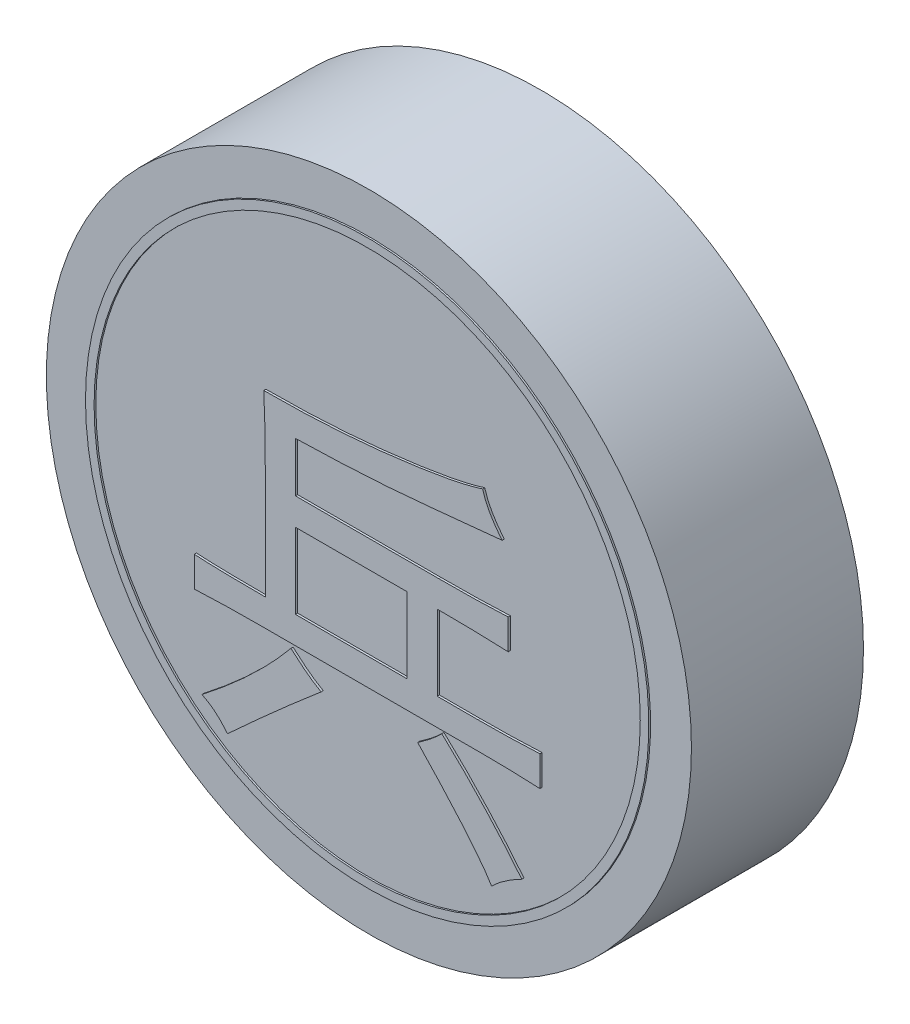
from build123d import *

# Parameters (mm, degrees)
SKETCH_1_R               = 15
DIAMETER30_HEIGHT8_DEPTH = 8
SKETCH_2_W               = 5.192982456
SKETCH_2_H               = 3.508771929
CHARACTER_DEPTH          = 0.1
SKETCH_3_R               = 13.1
SKETCH_3_R_2             = 12.7
INK_RING_DEPTH           = 0.08


with BuildPart() as part:
    # 草图1 → Diameter30_Height8 (new body)
    with BuildSketch(Plane.XY):
        Circle(SKETCH_1_R)
    extrude(amount=-DIAMETER30_HEIGHT8_DEPTH)

    # 草图2 → Character_兵 (add)
    # profile 1 of 3: a face of its own
    with BuildSketch(Plane.XY):
        with BuildLine():
            add(Edge.make_bspline(
                [(5.385964912, 5.675438596), (5.427646333, 5.544154901), (5.514415642, 5.270858182), (5.718534697, 4.870645294), (5.979105034, 4.460896452), (6.189038604, 4.198106369), (6.298245614, 4.061403509)],
                knots=[0, 0, 0, 0, 0.883893952, 1.840025262, 2.876385589, 4, 4, 4, 4], degree=3))
            add(Edge.make_bspline(
                [(6.298245614, 4.061403509), (5.963833471, 4.026716097), (5.279490907, 3.955731615), (4.231500891, 3.847667949), (3.138573287, 3.746554234), (2.199926718, 3.654410468), (1.420771678, 3.589929187), (0.809223667, 3.542341458), (0.175852477, 3.501012073), (-0.480095669, 3.465441213), (-1.157529916, 3.430930645), (-1.857588828, 3.402476855), (-2.579333786, 3.379715375), (-3.06800455, 3.366400533), (-3.315789474, 3.359649123)],
                knots=[0, 0, 0, 0, 1.255148332, 2.568541377, 3.933119286, 5.35274168, 6.089508688, 6.851809632, 7.642688325, 8.45900384, 9.304218247, 10.174988169, 11.074611272, 12, 12, 12, 12], degree=3))
            Line((-3.315789474, 3.359649123), (-3.315789474, 1.043859649))
            Line((-3.315789474, 1.043859649), (3.350877193, 1.043859649))
            add(Edge.make_bspline(
                [(3.350877193, 1.043859649), (3.511157354, 1.043351179), (3.823930109, 1.042358944), (4.282215924, 1.049417071), (4.718886002, 1.053533845), (5.133897674, 1.061104446), (5.526304771, 1.072707016), (5.896383806, 1.080969698), (6.244544047, 1.09823882), (6.469784841, 1.108878558), (6.578947368, 1.114035088)],
                knots=[0, 0, 0, 0, 1.191206585, 2.324535747, 3.406356757, 4.43677056, 5.409393768, 6.324087995, 7.187772401, 8, 8, 8, 8], degree=3))
            Line((6.578947368, 1.114035088), (6.578947368, -0.289473684))
            add(Edge.make_bspline(
                [(6.578947368, -0.289473684), (6.325999471, -0.278216628), (5.805513386, -0.255053199), (5.003105502, -0.23621154), (4.156642469, -0.222539126), (3.577870773, -0.220397737), (3.280701754, -0.219298246)],
                knots=[0, 0, 0, 0, 0.920900528, 1.894919528, 2.91915119, 4, 4, 4, 4], degree=3))
            Line((3.280701754, -0.219298246), (3.280701754, -3.728070175))
            Line((3.280701754, -3.728070175), (5.175438596, -3.728070175))
            add(Edge.make_bspline(
                [(5.175438596, -3.728070175), (5.437087744, -3.726975877), (5.945690026, -3.724848744), (6.687326433, -3.711192023), (7.384937776, -3.692513148), (7.835209995, -3.669167553), (8.052631579, -3.657894737)],
                knots=[0, 0, 0, 0, 1.090812078, 2.120356657, 3.092382303, 4, 4, 4, 4], degree=3))
            Line((8.052631579, -3.657894737), (8.052631579, -5.061403509))
            add(Edge.make_bspline(
                [(8.052631579, -5.061403509), (7.837808318, -5.050169454), (7.399653446, -5.027256405), (6.728050321, -5.008178757), (6.030595105, -4.994576557), (5.556645778, -4.992356355), (5.315789474, -4.99122807)],
                knots=[0, 0, 0, 0, 0.942753637, 1.922846234, 2.944411245, 4, 4, 4, 4], degree=3))
            Line((5.315789474, -4.99122807), (-4.929824561, -4.99122807))
            add(Edge.make_bspline(
                [(-4.929824561, -4.99122807), (-5.221796086, -4.992303015), (-5.783243216, -4.994370081), (-6.589858446, -5.007824944), (-7.327331729, -5.026367125), (-7.794924107, -5.050102938), (-8.01754386, -5.061403509)],
                knots=[0, 0, 0, 0, 1.134280796, 2.181167151, 3.134057485, 4, 4, 4, 4], degree=3))
            Line((-8.01754386, -5.061403509), (-8.01754386, -3.657894737))
            add(Edge.make_bspline(
                [(-8.01754386, -3.657894737), (-7.918780668, -3.663109409), (-7.710021339, -3.67413185), (-7.380044631, -3.691202686), (-7.016884144, -3.699292609), (-6.621013356, -3.710966152), (-6.192136611, -3.718460184), (-5.730343207, -3.722568458), (-5.235668056, -3.729595696), (-4.895172776, -3.728589765), (-4.719298246, -3.728070175)],
                knots=[0, 0, 0, 0, 0.719411058, 1.520645164, 2.403271333, 3.3614919, 4.401477414, 5.52328659, 6.720714106, 8, 8, 8, 8], degree=3))
            Line((-4.719298246, -3.728070175), (-4.719298246, 1.535087719))
            add(Edge.make_bspline(
                [(-4.719298246, 1.535087719), (-4.718784553, 1.689303498), (-4.717785992, 1.989081562), (-4.724827935, 2.426573997), (-4.728954195, 2.839853385), (-4.736476359, 3.228877821), (-4.748135548, 3.593555392), (-4.756324903, 3.934194089), (-4.77353537, 4.251158894), (-4.784297949, 4.45473273), (-4.789473684, 4.552631579)],
                knots=[0, 0, 0, 0, 1.226022714, 2.383249742, 3.478491498, 4.511863319, 5.476544353, 6.379262498, 7.220585815, 8, 8, 8, 8], degree=3))
            add(Edge.make_bspline(
                [(-4.789473684, 4.552631579), (-4.268706026, 4.556028892), (-3.23884814, 4.562747339), (-1.711781979, 4.634250298), (-0.219866652, 4.740633472), (0.993183313, 4.869797657), (1.923704926, 4.988295648), (2.567560235, 5.078693798), (3.161212168, 5.171746835), (3.703352911, 5.268528417), (4.196476895, 5.362226591), (4.637690365, 5.465343924), (5.030740941, 5.563211427), (5.272785841, 5.639681531), (5.385964912, 5.675438596)],
                knots=[0, 0, 0, 0, 1.826039719, 3.611133242, 5.359645429, 7.070379028, 7.888093123, 8.64899991, 9.350260421, 9.995089588, 10.580183652, 11.110071571, 11.583873602, 12, 12, 12, 12], degree=3))
        make_face()
        with Locations((-0.719298246, -1.973684211)):
            Rectangle(SKETCH_2_W, SKETCH_2_H, mode=Mode.SUBTRACT)
    # profile 2 of 3: a face of its own
    with BuildSketch(Plane.XY):
        with BuildLine():
            add(Edge.make_bspline(
                [(-2.122807018, -6.254385965), (-2.157477947, -6.282955909), (-2.239146675, -6.350253527), (-2.380099943, -6.467370774), (-2.555580621, -6.61772706), (-2.766181537, -6.799581185), (-3.010546273, -7.013645708), (-3.292157091, -7.257784349), (-3.608078345, -7.535369573), (-4.067550245, -7.940488445), (-4.641654961, -8.448307776), (-5.298106508, -9.038691618), (-5.905984263, -9.586353364), (-6.289571124, -9.942900475), (-6.473684211, -10.114035088)],
                knots=[0, 0, 0, 0, 0.2780539, 0.654966813, 1.134206325, 1.708249881, 2.37711475, 3.1448483, 4.014977533, 4.979944052, 6.936134783, 8.758754283, 10.444274784, 12, 12, 12, 12], degree=3))
            add(Edge.make_bspline(
                [(-6.473684211, -10.114035088), (-6.56675088, -10.003646022), (-6.746034395, -9.790992666), (-7.041333181, -9.517105251), (-7.343912266, -9.291855461), (-7.560952619, -9.184075455), (-7.666666667, -9.131578947)],
                knots=[0, 0, 0, 0, 1.110089453, 2.138474913, 3.093305237, 4, 4, 4, 4], degree=3))
            add(Edge.make_bspline(
                [(-7.666666667, -9.131578947), (-7.459526486, -8.969004344), (-7.051586638, -8.648831509), (-6.464306615, -8.155016872), (-5.902342388, -7.666058703), (-5.371814437, -7.172889256), (-4.86718458, -6.682628792), (-4.391277213, -6.192029207), (-3.945527473, -5.699881064), (-3.664825977, -5.366338586), (-3.526315789, -5.201754386)],
                knots=[0, 0, 0, 0, 1.104789882, 2.175762404, 3.219109849, 4.230036466, 5.214606813, 6.170942573, 7.097464421, 8, 8, 8, 8], degree=3))
            add(Edge.make_bspline(
                [(-3.526315789, -5.201754386), (-3.402072492, -5.313438732), (-3.163971761, -5.527471401), (-2.800509792, -5.808406095), (-2.461726053, -6.055622784), (-2.232199656, -6.190231325), (-2.122807018, -6.254385965)],
                knots=[0, 0, 0, 0, 1.1399807, 2.184667066, 3.134809496, 4, 4, 4, 4], degree=3))
        make_face()
    # profile 3 of 3: a face of its own
    with BuildSketch(Plane.XY):
        with BuildLine():
            add(Edge.make_bspline(
                [(3.49122807, -5.131578947), (3.64506879, -5.27574038), (3.958953573, -5.569876289), (4.429694762, -6.029809869), (4.906171195, -6.5186042), (5.550446937, -7.196959293), (6.333416052, -8.059114332), (6.921508711, -8.778189908), (7.210526316, -9.131578947)],
                knots=[0, 0, 0, 0, 0.694198963, 1.416390223, 2.166820141, 2.941675304, 4.4969891, 6, 6, 6, 6], degree=3))
            add(Edge.make_bspline(
                [(7.210526316, -9.131578947), (7.075068051, -9.202301891), (6.810022921, -9.340682313), (6.440864575, -9.578307626), (6.104530191, -9.83226378), (5.905037831, -10.021201035), (5.807017544, -10.114035088)],
                knots=[0, 0, 0, 0, 1.065427554, 2.08467446, 3.058907518, 4, 4, 4, 4], degree=3))
            add(Edge.make_bspline(
                [(5.807017544, -10.114035088), (5.775308721, -10.061834257), (5.708542231, -9.951919541), (5.596075389, -9.783319805), (5.468667601, -9.601351476), (5.325294262, -9.406676418), (5.167099041, -9.197729098), (4.988610452, -8.978683169), (4.801321577, -8.740479229), (4.591580283, -8.495595111), (4.370378942, -8.233593029), (4.132600709, -7.959359408), (3.876016732, -7.67337978), (3.606767352, -7.371008487), (3.318813913, -7.058440113), (3.015682826, -6.732539485), (2.699522295, -6.391233684), (2.480469315, -6.161414802), (2.368421053, -6.043859649)],
                knots=[0, 0, 0, 0, 0.549342762, 1.156702925, 1.82258923, 2.54738719, 3.331395419, 4.179695988, 5.088851071, 6.056731025, 7.079525855, 8.173336188, 9.321433762, 10.535553977, 11.815185591, 13.144150694, 14.539198359, 16, 16, 16, 16], degree=3))
            add(Edge.make_bspline(
                [(2.368421053, -6.043859649), (2.471264109, -5.972803187), (2.674770245, -5.832196455), (2.965216422, -5.609367892), (3.237954519, -5.37712719), (3.407172595, -5.213070577), (3.49122807, -5.131578947)],
                knots=[0, 0, 0, 0, 1.035169059, 2.048395507, 3.030582027, 4, 4, 4, 4], degree=3))
        make_face()
    extrude(amount=CHARACTER_DEPTH)

    # 草图3 → Ink_ring (add)
    with BuildSketch(Plane.XY):
        with Locations(Location((0, 0, 0), (0, 0, 180))):
            Circle(SKETCH_3_R)
        with Locations(Location((0, 0, 0), (0, 0, 180))):
            Circle(SKETCH_3_R_2, mode=Mode.SUBTRACT)
    extrude(amount=INK_RING_DEPTH)


solid = part.part
